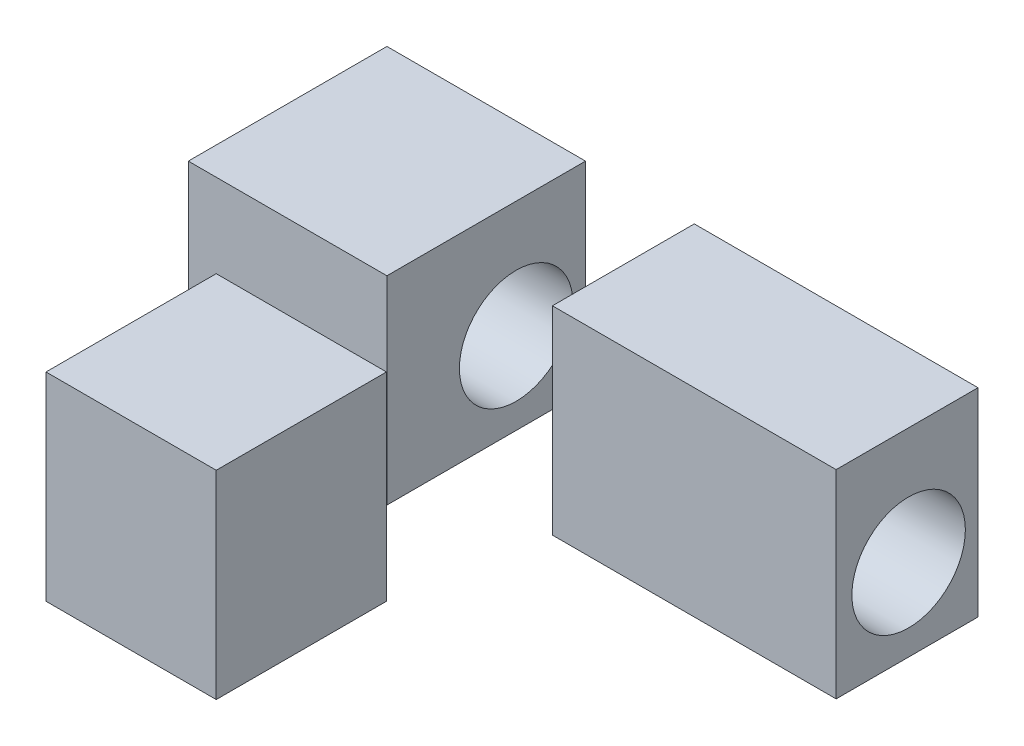
from build123d import *

# Parameters (mm, degrees)
SKETCH2_W             = 70
SKETCH2_H             = 70
BOSS_EXTRUDE1_DEPTH   = 70
SKETCH2_W_2           = 100
SKETCH2_H_2           = 50
BOSS_EXTRUDE1_2_DEPTH = 70
SKETCH2_W_3           = 60
SKETCH2_H_3           = 60
BOSS_EXTRUDE1_3_DEPTH = 70
SKETCH3_R             = 20
CUT_EXTRUDE1_DEPTH    = 251.536786883


with BuildPart() as part:
    # Sketch2 → Boss-Extrude1 (new body)
    with BuildSketch(Plane(origin=(0, 0, 0), x_dir=(1, 0, 0), z_dir=(0, 1, 0))):
        with Locations((-53.80952381, 4.166666667)):
            Rectangle(SKETCH2_W, SKETCH2_H)
    extrude(amount=BOSS_EXTRUDE1_DEPTH)


with BuildPart() as body_2:
    # Sketch2 → Boss-Extrude1 2 (new body)
    with BuildSketch(Plane(origin=(0, 0, 0), x_dir=(1, 0, 0), z_dir=(0, 1, 0))):
        with Locations((69.523809524, 14.166666667)):
            Rectangle(SKETCH2_W_2, SKETCH2_H_2)
    extrude(amount=BOSS_EXTRUDE1_2_DEPTH)


with BuildPart() as body_3:
    # Sketch2 → Boss-Extrude1 3 (new body)
    with BuildSketch(Plane(origin=(0, 0, 0), x_dir=(1, 0, 0), z_dir=(0, 1, 0))):
        with Locations((-19.523809524, -90.274285714)):
            Rectangle(SKETCH2_W_3, SKETCH2_H_3)
    extrude(amount=BOSS_EXTRUDE1_3_DEPTH)


with BuildPart() as cut_extrude1_tool:
    # Sketch3 → Cut-Extrude1 (new, through all)
    with BuildSketch(Plane(origin=(119.523809524, 0, 0), x_dir=(0, 0, -1), z_dir=(1, 0, 0))):
        with Locations((14.714433962, 28.902329944)):
            Circle(SKETCH3_R)
    extrude(amount=-CUT_EXTRUDE1_DEPTH)


with BuildPart() as part_1:
    add(part.part)

    # Cut-Extrude1: cut by cut_extrude1_tool
    add(cut_extrude1_tool.part, mode=Mode.SUBTRACT)


with BuildPart() as body_2_1:
    add(body_2.part)

    # Cut-Extrude1: cut by cut_extrude1_tool
    add(cut_extrude1_tool.part, mode=Mode.SUBTRACT)


solid = Compound([body_3.part, part_1.part, body_2_1.part])
